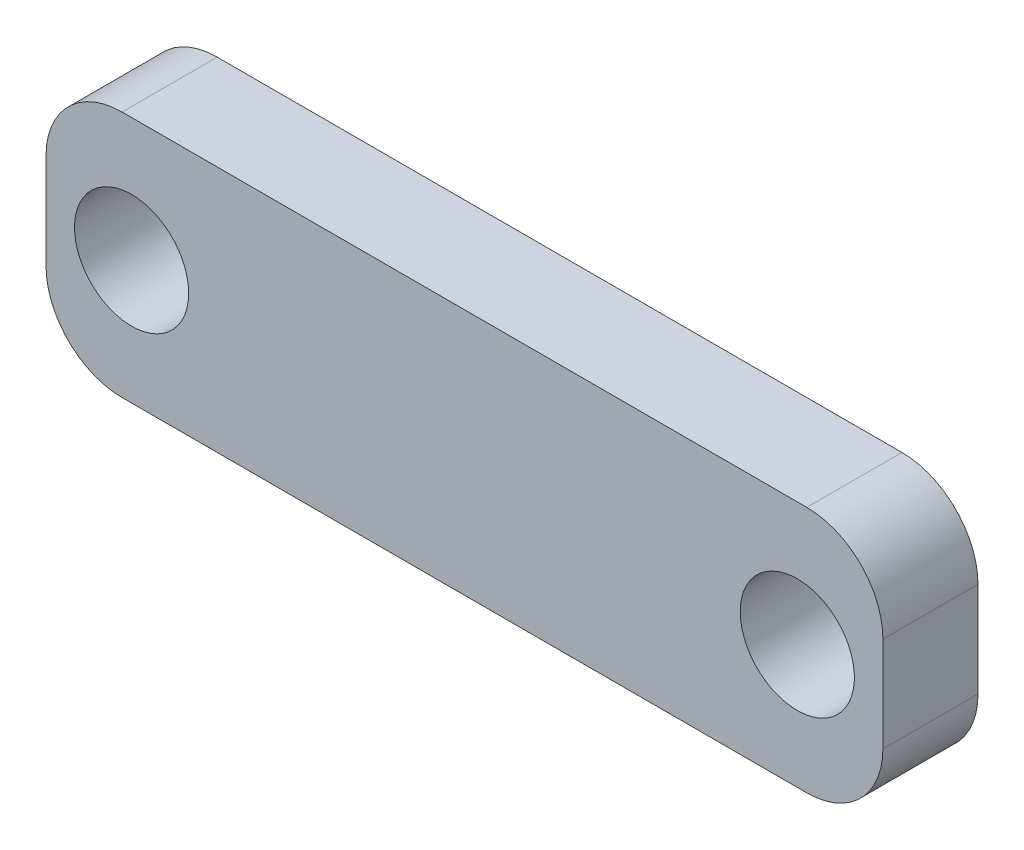
from build123d import *

# Parameters (mm, degrees)
SKETCH1_W           = 22
SKETCH1_H           = 6.5
SKETCH1_R           = 1.5
BOSS_EXTRUDE1_DEPTH = 2.5
FILLET4_R           = 2


with BuildPart() as part:
    # Sketch1 → Boss-Extrude1 (new body)
    with BuildSketch(Plane.XY):
        Rectangle(SKETCH1_W, SKETCH1_H)
        with Locations((-8.75, 0)):
            Circle(SKETCH1_R, mode=Mode.SUBTRACT)
        with Locations(Location((8.75, 0, 0), (0, 0, 180))):
            Circle(SKETCH1_R, mode=Mode.SUBTRACT)
    extrude(amount=BOSS_EXTRUDE1_DEPTH)

    # Fillet4
    fillet4_edges = [part.edges().sort_by_distance(p)[0] for p in [
        (11, -3.25, 1.25),
        (-11, -3.25, 1.25),
        (-11, 3.25, 1.25),
        (11, 3.25, 1.25),
    ]]
    fillet(fillet4_edges, radius=FILLET4_R)


solid = part.part
